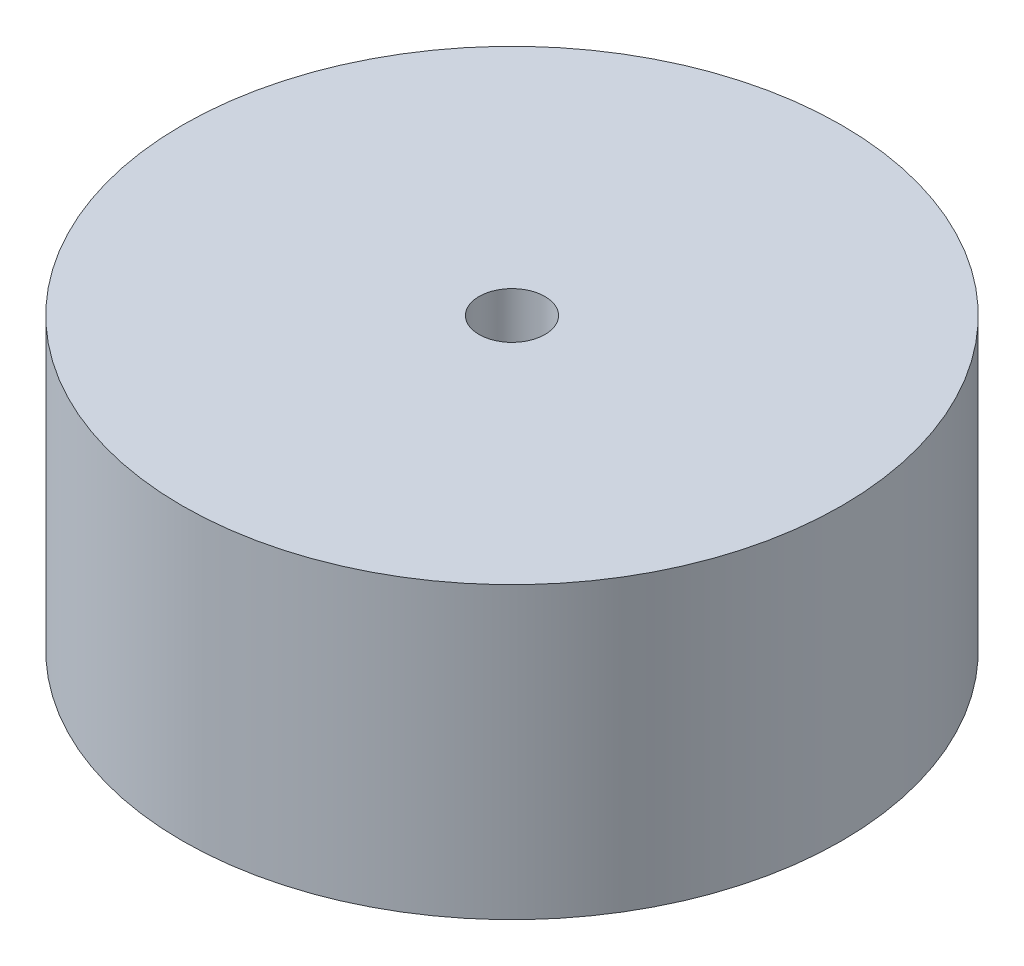
from build123d import *

# Parameters (mm, degrees)
SKETCH_1_R          = 50
EXTRUDE_3_DEPTH     = 45
SKETCH_5_R          = 5
CUT_EXTRUDE_1_DEPTH = 84.815273071
CUT_EXTRUDE_START   = -5
SKETCH_6_R          = 50
CUT_EXTRUDE_2_DEPTH = 5
SCALE_3_SCALE       = 0.5
SCALE_4_SCALE       = 1.2
SKETCH_7_R          = 30
SKETCH_7_R_2        = 3
EXTRUDE_4_DEPTH     = 2.4


with BuildPart() as part:
    # 草图1 → 凸台-拉伸3 (new body)
    with BuildSketch(Plane(origin=(0, 0, 0), x_dir=(1, 0, 0), z_dir=(0, 1, 0))):
        with Locations(Location((0, 0, 0), (0, 0, 90))):
            Circle(SKETCH_1_R)
    extrude(amount=EXTRUDE_3_DEPTH)

    # 草图5 → 切除-拉伸1 (cut, through all)
    with BuildSketch(Plane.XZ):
        with Locations(Location((0, 0, 0), (0, 0, 270))):
            Circle(SKETCH_5_R)
    extrude(amount=-CUT_EXTRUDE_1_DEPTH, mode=Mode.SUBTRACT)

    # 草图6 → 切除-拉伸2 (cut)
    with BuildSketch(Plane(origin=(0, 45, 0), x_dir=(1, 0, 0), z_dir=(0, 1, 0)).offset(CUT_EXTRUDE_START)):
        with Locations(Location((0, 0, 0), (0, 0, 90))):
            Circle(SKETCH_6_R)
    extrude(amount=CUT_EXTRUDE_2_DEPTH, mode=Mode.SUBTRACT)


with BuildPart() as part_1:
    # 缩放比例3: scaled about (0, 20, 0)
    add(part.part.scale(SCALE_3_SCALE).moved(Location((0, 10, 0))))


with BuildPart() as part_2:
    # 缩放比例4: scaled about (0, 20, 0)
    add(part_1.part.scale(SCALE_4_SCALE).moved(Location((0, -4, 0))))

    # 草图7 → 凸台-拉伸4 (add)
    with BuildSketch(Plane(origin=(0, 32, 0), x_dir=(1, 0, 0), z_dir=(0, 1, 0))):
        with Locations(Location((0, 0, 0), (0, 0, 90))):
            Circle(SKETCH_7_R)
        with Locations(Location((0, 0, 0), (0, 0, 90))):
            Circle(SKETCH_7_R_2, mode=Mode.SUBTRACT)
    extrude(amount=EXTRUDE_4_DEPTH)


solid = part_2.part
